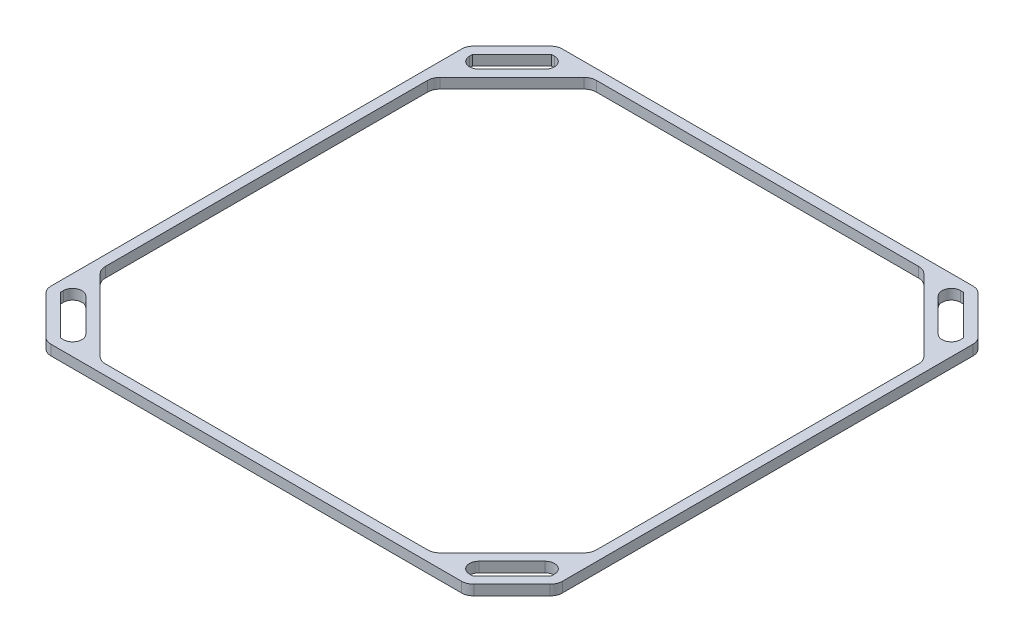
from build123d import *

# Parameters (mm, degrees)
BOSS_EXTRUDE1_DEPTH = 1.65
FILLET1_R           = 2
FILLET2_R           = 2
FILLET3_R           = 1.5


with BuildPart() as part:
    # Sketch1 → Boss-Extrude1 (new body)
    with BuildSketch(Plane(origin=(0, 0, 0), x_dir=(1, 0, 0), z_dir=(0, 1, 0))):
        Polygon((-41.448800006, 34.091704203), (-34.091704203, 41.448800006), (34.091704203, 41.448800006), (41.448800006, 34.091704203), (41.448800006, -34.091704203), (34.091704203, -41.448800006), (-34.091704203, -41.448800006), (-41.448800006, -34.091704203), align=None)
        Polygon((-39.798800006, 33.408251825), (-33.408251825, 39.798800006), (-29.292890359, 39.798800006), (-39.798800006, 29.292890359), align=None, mode=Mode.SUBTRACT)
        Polygon((-33.408251825, -39.798800006), (-29.292890359, -39.798800006), (-39.798800006, -29.292890359), (-39.798800006, -33.408251825), align=None, mode=Mode.SUBTRACT)
        Polygon((39.798800006, -33.408251825), (39.798800006, -29.292890359), (29.292890359, -39.798800006), (33.408251825, -39.798800006), align=None, mode=Mode.SUBTRACT)
        Polygon((33.408251825, 39.798800006), (39.798800006, 33.408251825), (39.798800006, 29.292890359), (29.292890359, 39.798800006), align=None, mode=Mode.SUBTRACT)
        Polygon((-39.798800006, 26.959437981), (-26.959437981, 39.798800006), (26.959437981, 39.798800006), (39.798800006, 26.959437981), (39.798800006, -26.959437981), (26.959437981, -39.798800006), (-26.959437981, -39.798800006), (-39.798800006, -26.959437981), align=None, mode=Mode.SUBTRACT)
    extrude(amount=BOSS_EXTRUDE1_DEPTH)

    # Fillet1
    fillet1_edges = [part.edges().sort_by_distance(p)[0] for p in [
        (-41.448800006, 0.825, -34.091704203),
        (-34.091704203, 0.825, -41.448800006),
        (-39.798800006, 0.825, -26.959437981),
        (-26.959437981, 0.825, -39.798800006),
    ]]
    fillet(fillet1_edges, radius=FILLET1_R)

    # Fillet2
    fillet2_edges = [part.edges().sort_by_distance(p)[0] for p in [
        (34.091704203, 0.825, -41.448800006),
        (41.448800006, 0.825, -34.091704203),
        (41.448800006, 0.825, 34.091704203),
        (34.091704203, 0.825, 41.448800006),
        (-34.091704203, 0.825, 41.448800006),
        (-41.448800006, 0.825, 34.091704203),
        (-39.798800006, 0.825, 26.959437981),
        (-26.959437981, 0.825, 39.798800006),
        (26.959437981, 0.825, 39.798800006),
        (39.798800006, 0.825, 26.959437981),
        (39.798800006, 0.825, -26.959437981),
        (26.959437981, 0.825, -39.798800006),
    ]]
    fillet(fillet2_edges, radius=FILLET2_R)

    # Fillet3
    fillet3_edges = [part.edges().sort_by_distance(p)[0] for p in [
        (-39.798800006, 0.825, -29.292890359),
        (-29.292890359, 0.825, -39.798800006),
        (29.292890359, 0.825, -39.798800006),
        (39.798800006, 0.825, -29.292890359),
        (39.798800006, 0.825, 29.292890359),
        (29.292890359, 0.825, 39.798800006),
        (-29.292890359, 0.825, 39.798800006),
        (-39.798800006, 0.825, 29.292890359),
    ]]
    fillet(fillet3_edges, radius=FILLET3_R)


solid = part.part
